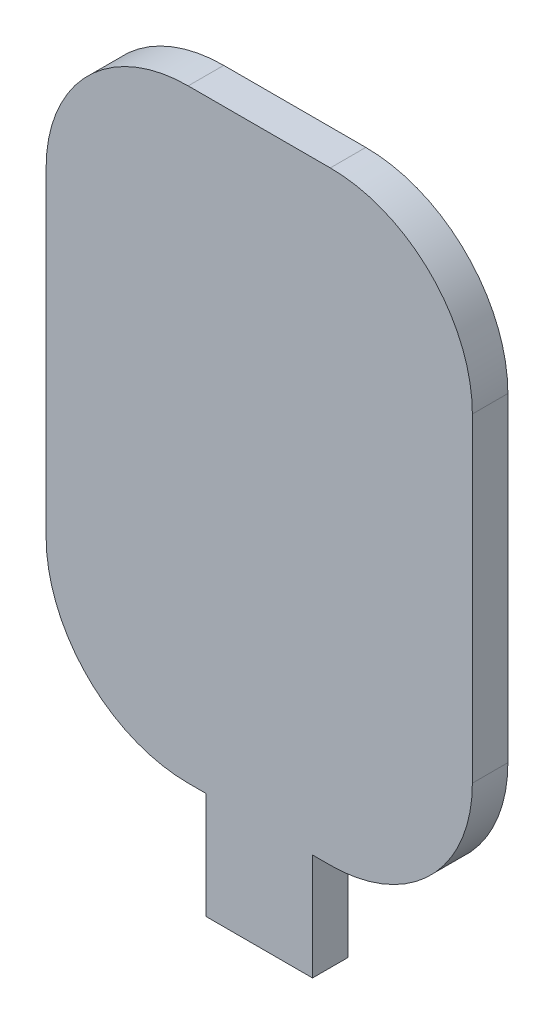
from build123d import *

# Parameters (mm, degrees)
BOSS_EXTRUDE1_DEPTH = 3.175


with BuildPart() as part:
    # Sketch1 → Boss-Extrude1 (new body)
    with BuildSketch(Plane.XY):
        with BuildLine():
            Line((9.525, 9.525), (11.1125, 9.525))
            ThreePointArc((11.1125, 9.525), (20.092756121, 13.244743879), (23.8125, 22.225))
            Line((23.8125, 22.225), (23.8125, 50.8))
            ThreePointArc((23.8125, 50.8), (20.092756121, 59.780256121), (11.1125, 63.5))
            Line((11.1125, 63.5), (-1.5875, 63.5))
            ThreePointArc((-1.5875, 63.5), (-10.567756121, 59.780256121), (-14.2875, 50.8))
            Line((-14.2875, 50.8), (-14.2875, 22.225))
            ThreePointArc((-14.2875, 22.225), (-10.567756121, 13.244743879), (-1.5875, 9.525))
            Line((-1.5875, 9.525), (0, 9.525))
            Line((0, 9.525), (0, 0))
            Line((0, 0), (9.525, 0))
            Line((9.525, 0), (9.525, 9.525))
        make_face()
    extrude(amount=BOSS_EXTRUDE1_DEPTH)


solid = part.part
